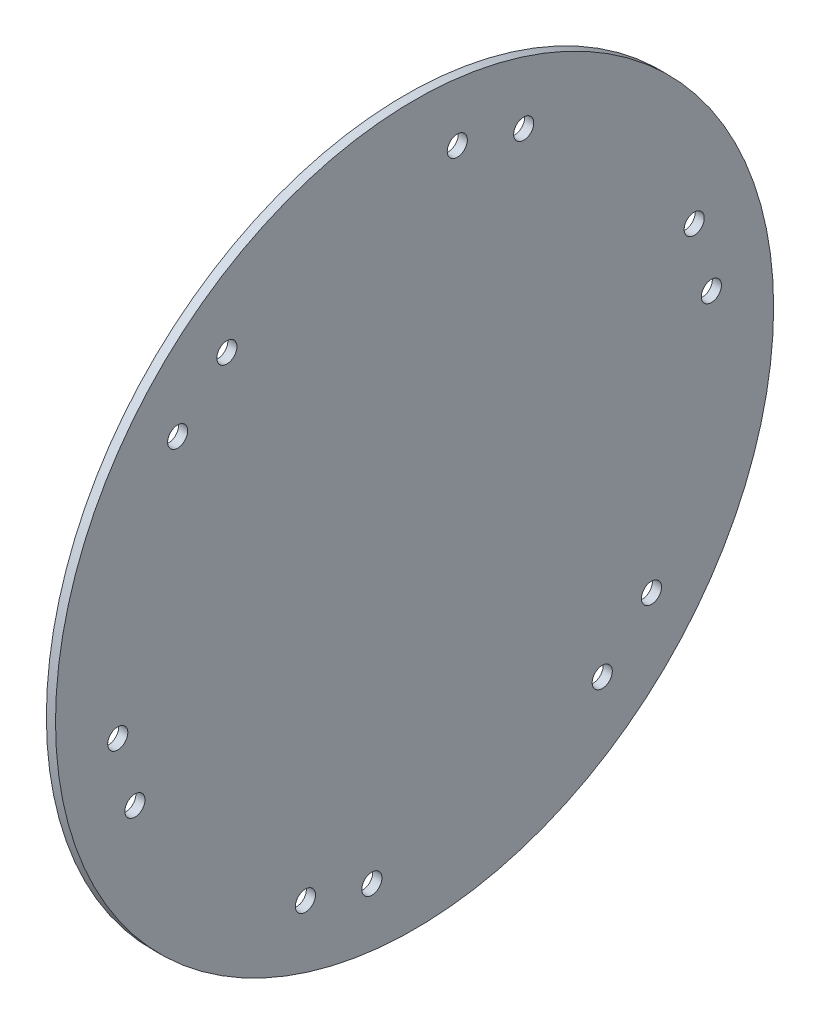
from build123d import *

# Parameters (mm, degrees)
SKETCH2_R           = 125
BOSS_EXTRUDE1_DEPTH = 3.18
SKETCH3_R           = 3.5
CUT_EXTRUDE1_DEPTH  = 177.80529517


with BuildPart() as part:
    # Sketch2 → Boss-Extrude1 (new body)
    with BuildSketch(Plane(origin=(0, 0, 0), x_dir=(0, 0, -1), z_dir=(1, 0, 0))):
        with Locations(Location((0, 0, 0), (0, 0, 180))):
            Circle(SKETCH2_R)
    extrude(amount=BOSS_EXTRUDE1_DEPTH)

    # Sketch3 → Cut-Extrude1 (cut, through all)
    with BuildSketch(Plane.ZY):
        with Locations((103.329056078, -15.785012269)):
            Circle(SKETCH3_R)
        with Locations((97.341910159, -39.026227464)):
            Circle(SKETCH3_R)
        with Locations((14.873250681, -103.813680783)):
            Circle(SKETCH3_R)
        with Locations((37.994306415, -97.378093647)):
            Circle(SKETCH3_R)
        with Locations((-65.334749663, -81.593081378)):
            Circle(SKETCH3_R)
        with Locations((-82.468659478, -64.787453318)):
            Circle(SKETCH3_R)
        with Locations((-97.341910159, 39.026227464)):
            Circle(SKETCH3_R)
        with Locations((-103.329056078, 15.785012269)):
            Circle(SKETCH3_R)
        with Locations((-37.994306415, 97.378093647)):
            Circle(SKETCH3_R)
        with Locations((-14.873250681, 103.813680783)):
            Circle(SKETCH3_R)
        with Locations((65.334749663, 81.593081378)):
            Circle(SKETCH3_R)
        with Locations((82.468659478, 64.787453318)):
            Circle(SKETCH3_R)
    extrude(amount=-CUT_EXTRUDE1_DEPTH, mode=Mode.SUBTRACT)


solid = part.part
